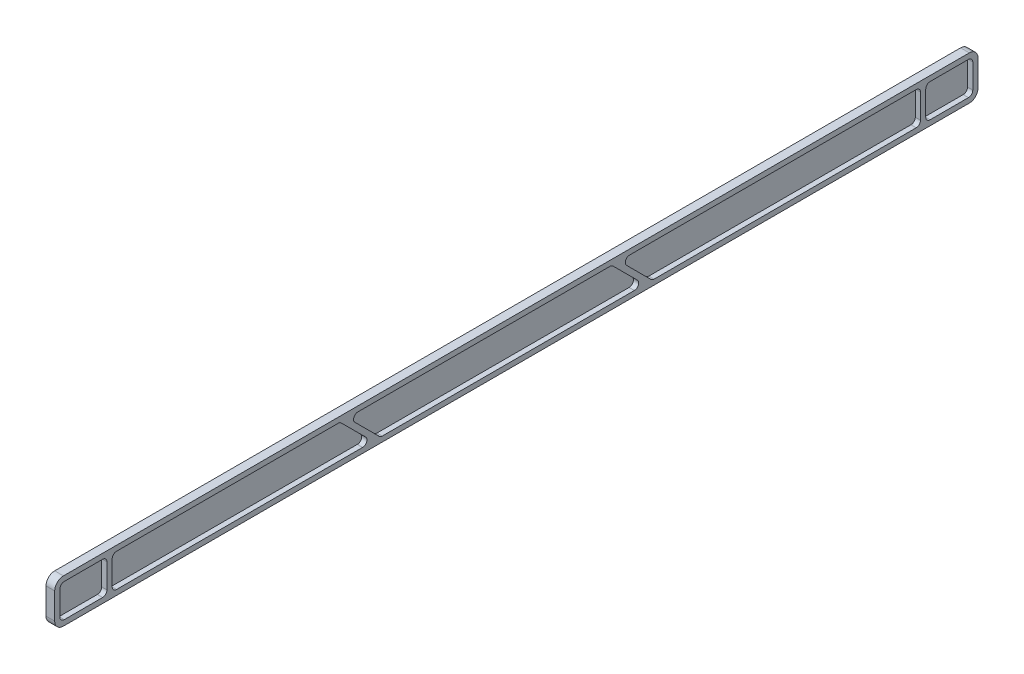
from build123d import *

# Parameters (mm, degrees)
BOSS_EXTRUDE3_DEPTH = 2
SKETCH1_5_W         = 27
SKETCH1_5_H         = 19
BOSS_EXTRUDE4_DEPTH = 3
FILLET1_R           = 5
FILLET2_R           = 2.5
FILLET3_R           = 2.5


with BuildPart() as part:
    # Sketch1 → Boss-Extrude3 (new body)
    with BuildSketch(Plane(origin=(0, 0, 0), x_dir=(0, 0, -1), z_dir=(1, 0, 0))):
        Polygon((-265, -12.5), (0, -12.5), (265, -12.5), (265, 12.5), (-265, 12.5), align=None)
    extrude(amount=-BOSS_EXTRUDE3_DEPTH)

    # Sketch1<5> → Boss-Extrude4 (add)
    with BuildSketch(Plane(origin=(0, 0, 0), x_dir=(0, 0, -1), z_dir=(1, 0, 0))):
        Polygon((-265, -12.5), (0, -12.5), (265, -12.5), (265, 12.5), (-265, 12.5), align=None)
        with Locations((-248.5, 0)):
            Rectangle(SKETCH1_5_W, SKETCH1_5_H, mode=Mode.SUBTRACT)
        Polygon((-82.242640687, -9.5), (-232, -9.5), (-232, 9.5), (-101.242640687, 9.5), align=None, mode=Mode.SUBTRACT)
        Polygon((0, -9.5), (-78, -9.5), (-97, 9.5), (54.757359313, 9.5), (73.757359313, -9.5), align=None, mode=Mode.SUBTRACT)
        Polygon((232, -9.5), (78, -9.5), (59, 9.5), (232, 9.5), align=None, mode=Mode.SUBTRACT)
        with Locations((248.5, 0)):
            Rectangle(SKETCH1_5_W, SKETCH1_5_H, mode=Mode.SUBTRACT)
    extrude(amount=BOSS_EXTRUDE4_DEPTH)

    # Fillet1
    fillet1_edges = [part.edges().sort_by_distance(p)[0] for p in [
        (0.5, 12.5, -265),
        (0.5, -12.5, -265),
        (0.5, 12.5, 265),
        (0.5, -12.5, 265),
    ]]
    fillet(fillet1_edges, radius=FILLET1_R)

    # Fillet2
    fillet2_edges = [part.edges().sort_by_distance(p)[0] for p in [
        (1.5, -9.5, -262),
        (1.5, 9.5, -262),
        (1.5, -9.5, 262),
        (1.5, 9.5, 262),
    ]]
    fillet(fillet2_edges, radius=FILLET2_R)

    # Fillet3
    fillet3_edges = [part.edges().sort_by_distance(p)[0] for p in [
        (1.5, -9.5, -235),
        (1.5, 9.5, -235),
        (1.5, 9.5, -232),
        (1.5, -9.5, -232),
        (1.5, 9.5, -59),
        (1.5, -9.5, -78),
        (1.5, -9.5, -73.757359313),
        (1.5, 9.5, -54.757359313),
        (1.5, 9.5, 97),
        (1.5, -9.5, 78),
        (1.5, -9.5, 82.242640687),
        (1.5, 9.5, 101.242640687),
        (1.5, -9.5, 232),
        (1.5, 9.5, 232),
        (1.5, -9.5, 235),
        (1.5, 9.5, 235),
    ]]
    fillet(fillet3_edges, radius=FILLET3_R)


solid = part.part
